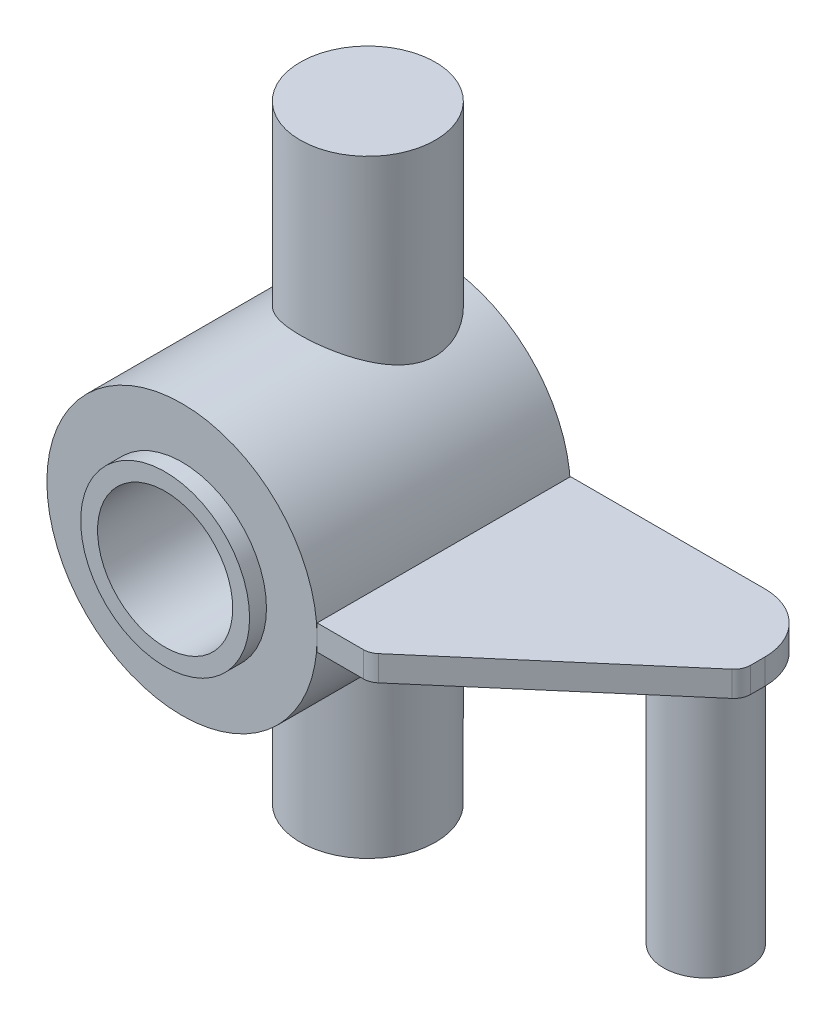
from build123d import *

# Parameters (mm, degrees)
SKETCH1_R                            = 8
BOSS_EXTRUDE1_DEPTH                  = 15
SKETCH2_R                            = 5
SKETCH2_R_2                          = 4
BOSS_EXTRUDE2_DEPTH                  = 1
CUT_EXTRUDE1_START                   = -15
SKETCH3_R                            = 4
CUT_EXTRUDE1_DEPTH                   = 15
SKETCH4_R                            = 4
BOSS_EXTRUDE3_DEPTH                  = 10
BOSS_EXTRUDE3_DIRECTION_2_REACH      = 26
BOSS_EXTRUDE3_DIRECTION_2_END_RADIUS = 8
SKETCH6_R                            = 4
BOSS_EXTRUDE4_DEPTH                  = 10
BOSS_EXTRUDE4_DIRECTION_2_REACH      = 33.559
BOSS_EXTRUDE4_DIRECTION_2_END_RADIUS = 8
SKETCH7_W                            = 15
SKETCH7_H                            = 1.5
BOSS_EXTRUDE5_DEPTH                  = 15
CUT_EXTRUDE2_DEPTH                   = 15
CUT_EXTRUDE3_DEPTH                   = 15
FILLET1_R                            = 1
FILLET2_R                            = 1
SKETCH12_R                           = 2.5
BOSS_EXTRUDE6_DEPTH                  = 15


with BuildPart() as part:
    # Sketch1 → Boss-Extrude1 (new body)
    with BuildSketch(Plane.XY):
        Circle(SKETCH1_R)
    extrude(amount=BOSS_EXTRUDE1_DEPTH)

    # Sketch2 → Boss-Extrude2 (add)
    with BuildSketch(Plane.XY.offset(15)):
        Circle(SKETCH2_R)
        Circle(SKETCH2_R_2, mode=Mode.SUBTRACT)
    extrude(amount=BOSS_EXTRUDE2_DEPTH)

    # Sketch3 → Cut-Extrude1 (cut)
    with BuildSketch(Plane.XY.offset(15).offset(CUT_EXTRUDE1_START)):
        Circle(SKETCH3_R)
    extrude(amount=CUT_EXTRUDE1_DEPTH, mode=Mode.SUBTRACT)

    # Sketch6 → Boss-Extrude4 (add)
    with BuildSketch(Plane(origin=(0, -8, 0), x_dir=(-1, 0, 0), z_dir=(0, -1, 0))):
        with Locations(Location((0, -4, 0), (0, 0, 270))):
            Circle(SKETCH6_R)
    extrude(amount=BOSS_EXTRUDE4_DEPTH)

    # Boss-Extrude4 direction 2: up to this cylinder (the profile starts outside it)
    boss_extrude4_direction_2_end = Plane(origin=(0, 0, 4), z_dir=(0, 0, -1)) * Cylinder(BOSS_EXTRUDE4_DIRECTION_2_END_RADIUS, 84.118, mode=Mode.PRIVATE)
    # Sketch6 → Boss-Extrude4 direction 2 (add, up to the surface)
    with BuildSketch(Plane(origin=(0, -8, 0), x_dir=(-1, 0, 0), z_dir=(0, -1, 0)), mode=Mode.PRIVATE) as boss_extrude4_direction_2_sk1:
        with Locations(Location((0, -4, 0), (0, 0, 270))):
            Circle(SKETCH6_R)
    boss_extrude4_direction_2_tool1 = extrude(boss_extrude4_direction_2_sk1.sketch, amount=-BOSS_EXTRUDE4_DIRECTION_2_REACH, mode=Mode.PRIVATE) - boss_extrude4_direction_2_end
    add(boss_extrude4_direction_2_tool1.solids().sort_by_distance((0, -8, 4))[0])
    add(boss_extrude4_direction_2_tool1.solids().sort_by_distance((0, -8, 4))[1])


with BuildPart() as body_2:
    # Sketch4 → Boss-Extrude3 (new body)
    with BuildSketch(Plane(origin=(0, 8, 0), x_dir=(1, 0, 0), z_dir=(0, 1, 0))):
        with Locations(Location((0, -4, 0), (0, 0, 270))):
            Circle(SKETCH4_R)
    extrude(amount=BOSS_EXTRUDE3_DEPTH)

    # Boss-Extrude3 direction 2: up to this cylinder (the profile starts outside it)
    boss_extrude3_direction_2_end = Plane(origin=(0, 0, 4), z_dir=(0, 0, -1)) * Cylinder(BOSS_EXTRUDE3_DIRECTION_2_END_RADIUS, 69, mode=Mode.PRIVATE)
    # Sketch4 → Boss-Extrude3 direction 2 (add, up to the surface)
    with BuildSketch(Plane(origin=(0, 8, 0), x_dir=(1, 0, 0), z_dir=(0, 1, 0)), mode=Mode.PRIVATE) as boss_extrude3_direction_2_sk1:
        with Locations(Location((0, -4, 0), (0, 0, 270))):
            Circle(SKETCH4_R)
    boss_extrude3_direction_2_tool1 = extrude(boss_extrude3_direction_2_sk1.sketch, amount=-BOSS_EXTRUDE3_DIRECTION_2_REACH, mode=Mode.PRIVATE) - boss_extrude3_direction_2_end
    add(boss_extrude3_direction_2_tool1.solids().sort_by_distance((0, 8, 4))[0])
    add(boss_extrude3_direction_2_tool1.solids().sort_by_distance((0, 8, 4))[1])


with BuildPart() as body_3:
    # Sketch7 → Boss-Extrude5 (new body)
    with BuildSketch(Plane(origin=(8, 0, 0), x_dir=(0, 0, -1), z_dir=(1, 0, 0))):
        with Locations((-7.5, 0)):
            Rectangle(SKETCH7_W, SKETCH7_H)
    extrude(amount=BOSS_EXTRUDE5_DEPTH)

    # Sketch9 → Cut-Extrude2 (cut)
    with BuildSketch(Plane.XZ.offset(0.75)):
        with BuildLine():
            ThreePointArc((23, 3.5), (21.974873734, 1.025126266), (19.5, 0))
            Line((19.5, 0), (23, 0))
            Line((23, 0), (23, 3.5))
        make_face()
    extrude(amount=-CUT_EXTRUDE2_DEPTH, mode=Mode.SUBTRACT)

    # Sketch11 → Cut-Extrude3 (cut)
    with BuildSketch(Plane(origin=(0, -0.75, 0), x_dir=(-1, 0, 0), z_dir=(0, -1, 0))):
        Polygon((-23, -15), (-11.108053079, -15), (-23, -4.792841708), align=None)
    extrude(amount=-CUT_EXTRUDE3_DEPTH, mode=Mode.SUBTRACT)

    # Fillet1
    fillet1_edges = [body_3.edges().sort_by_distance(p)[0] for p in [
        (11.108053079, 0, 15),
    ]]
    fillet(fillet1_edges, radius=FILLET1_R)

    # Fillet2
    fillet2_edges = [body_3.edges().sort_by_distance(p)[0] for p in [
        (23, 0, 4.792841708),
    ]]
    fillet(fillet2_edges, radius=FILLET2_R)

    # Sketch12 → Boss-Extrude6 (add)
    with BuildSketch(Plane.XZ.offset(0.75)):
        with Locations(Location((19.446318933, 3.434994956, 0), (0, 0, 90))):
            Circle(SKETCH12_R)
    extrude(amount=BOSS_EXTRUDE6_DEPTH)


solid = Compound([part.part, body_2.part, body_3.part])
